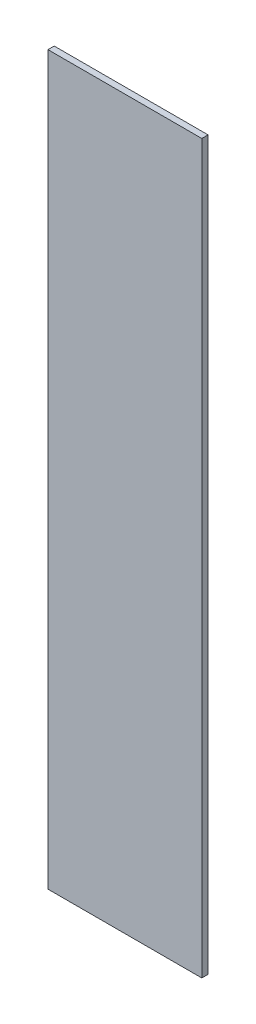
from build123d import *

# Parameters (mm, degrees)
CROQUIS1_W              = 76.2
CROQUIS1_H              = 360
SALIENTE_EXTRUIR1_DEPTH = 3.1


with BuildPart() as part:
    # Croquis1 → Saliente-Extruir1 (new body)
    with BuildSketch(Plane.XY):
        Rectangle(CROQUIS1_W, CROQUIS1_H)
    extrude(amount=SALIENTE_EXTRUIR1_DEPTH)


solid = part.part
